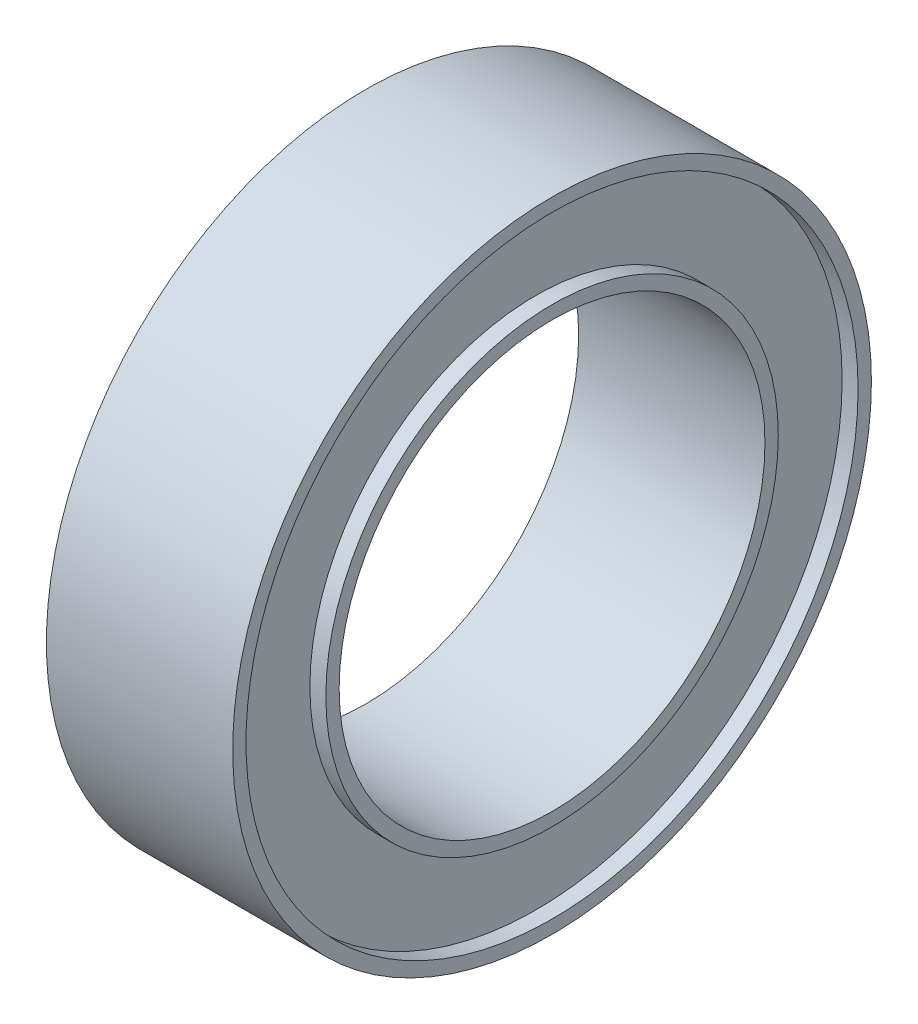
from build123d import *

# Parameters (mm, degrees)
SKETCH1_R           = 6
BOSS_EXTRUDE1_DEPTH = 1.75
CUT_EXTRUDE1_REACH  = 11.179
SKETCH2_R           = 4
SKETCH3_R           = 5.75
SKETCH3_R_2         = 4.25
CUT_EXTRUDE2_DEPTH  = 0.3


with BuildPart() as part:
    # Sketch1 → Boss-Extrude1 (new, symmetric)
    with BuildSketch(Plane(origin=(0, 0, 0), x_dir=(0, 0, -1), z_dir=(1, 0, 0))):
        Circle(SKETCH1_R)
    extrude(amount=BOSS_EXTRUDE1_DEPTH, both=True)

    # Sketch2 → Cut-Extrude1 (cut, up to next)
    with BuildSketch(Plane(origin=(1.75, 0, 0), x_dir=(0, 0, -1), z_dir=(1, 0, 0)), mode=Mode.PRIVATE) as cut_extrude1_sk1:
        Circle(SKETCH2_R)
    cut_extrude1_tool1 = extrude(cut_extrude1_sk1.sketch, amount=-CUT_EXTRUDE1_REACH, mode=Mode.PRIVATE) & part.part
    add(cut_extrude1_tool1.solids().sort_by_distance((1.75, 0, 0))[0], mode=Mode.SUBTRACT)

    # Sketch3 → Cut-Extrude2 (cut)
    with BuildSketch(Plane(origin=(1.75, 0, 0), x_dir=(0, 0, -1), z_dir=(1, 0, 0))):
        Circle(SKETCH3_R)
        Circle(SKETCH3_R_2, mode=Mode.SUBTRACT)
    cut_extrude2 = extrude(amount=-CUT_EXTRUDE2_DEPTH, mode=Mode.SUBTRACT)

    # Mirror1: Cut-Extrude2 across plane
    add(cut_extrude2.mirror(Plane(origin=(0, 0, 0), x_dir=(0, 0, 1), z_dir=(1, 0, 0))), mode=Mode.SUBTRACT)


solid = part.part
